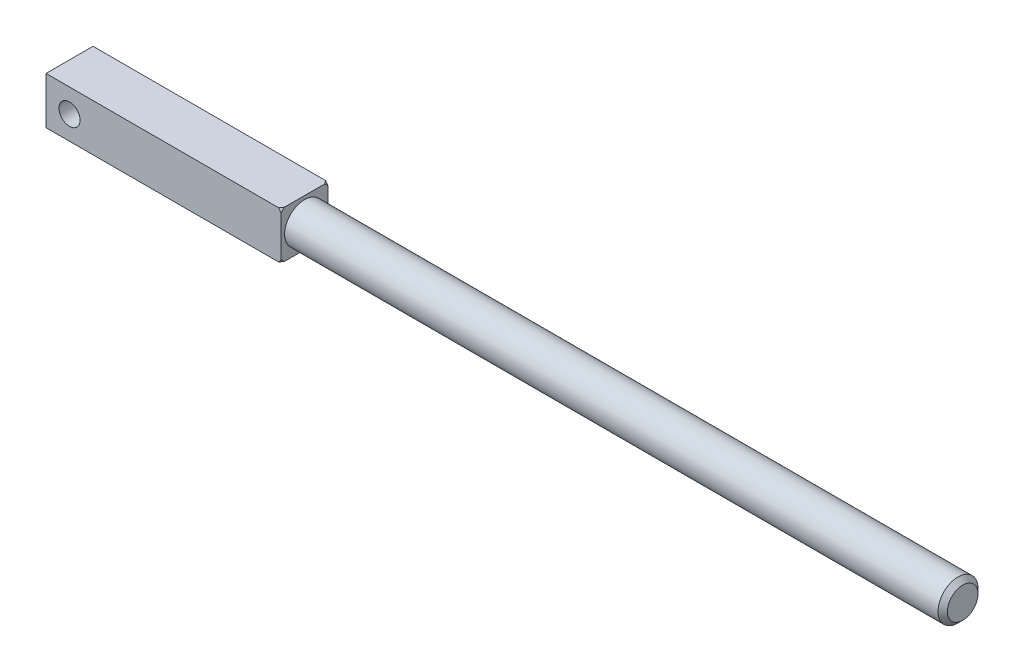
from build123d import *

# Parameters (mm, degrees)
SKETCH1_W           = 10
SKETCH1_H           = 10
BOSS_EXTRUDE1_DEPTH = 50
SKETCH3_R           = 4.25
BOSS_EXTRUDE2_DEPTH = 140
CHAMFER1_SIZE       = 1
SKETCH7_R           = 4
CUT_EXTRUDE3_DEPTH  = 4.5
SKETCH7_5_R         = 2.25
CUT_EXTRUDE4_DEPTH  = 20


with BuildPart() as part:
    # Sketch1 → Boss-Extrude1 (new body)
    with BuildSketch(Plane(origin=(0, 0, 0), x_dir=(0, 0, -1), z_dir=(1, 0, 0))):
        Rectangle(SKETCH1_W, SKETCH1_H)
    extrude(amount=BOSS_EXTRUDE1_DEPTH)

    # Sketch3 → Boss-Extrude2 (add)
    with BuildSketch(Plane(origin=(50, 0, 0), x_dir=(0, 0, -1), z_dir=(1, 0, 0))):
        Circle(SKETCH3_R)
    extrude(amount=BOSS_EXTRUDE2_DEPTH)

    # Chamfer1
    chamfer1_edges = [part.edges().sort_by_distance(p)[0] for p in [
        (190, 0, 4.25),
    ]]
    chamfer(chamfer1_edges, length=CHAMFER1_SIZE)

    # Sketch5 → Cut-Revolve1 (revolve, cut)
    with BuildSketch(Plane(origin=(0, 0, 0), x_dir=(-1, 0, 0), z_dir=(0, -0.7071067811865476, -0.7071067811865476))):
        Polygon((-50, 7.071067812), (-50, 6.571067812), (-49.5, 7.071067812), align=None)
    revolve(axis=Axis((-14.523088714, 0, 0), (1, 0, 0)), mode=Mode.SUBTRACT)

    # Sketch7 → Cut-Extrude3 (cut)
    with BuildSketch(Plane(origin=(0, 0, -5), x_dir=(-1, 0, 0), z_dir=(0, 0, -1))):
        with Locations((-5, 0)):
            Circle(SKETCH7_R)
    extrude(amount=-CUT_EXTRUDE3_DEPTH, mode=Mode.SUBTRACT)

    # Sketch7<5> → Cut-Extrude4 (cut)
    with BuildSketch(Plane(origin=(0, 0, -5), x_dir=(-1, 0, 0), z_dir=(0, 0, -1))):
        with Locations((-5, 0)):
            Circle(SKETCH7_5_R)
    extrude(amount=-CUT_EXTRUDE4_DEPTH, mode=Mode.SUBTRACT)


solid = part.part
